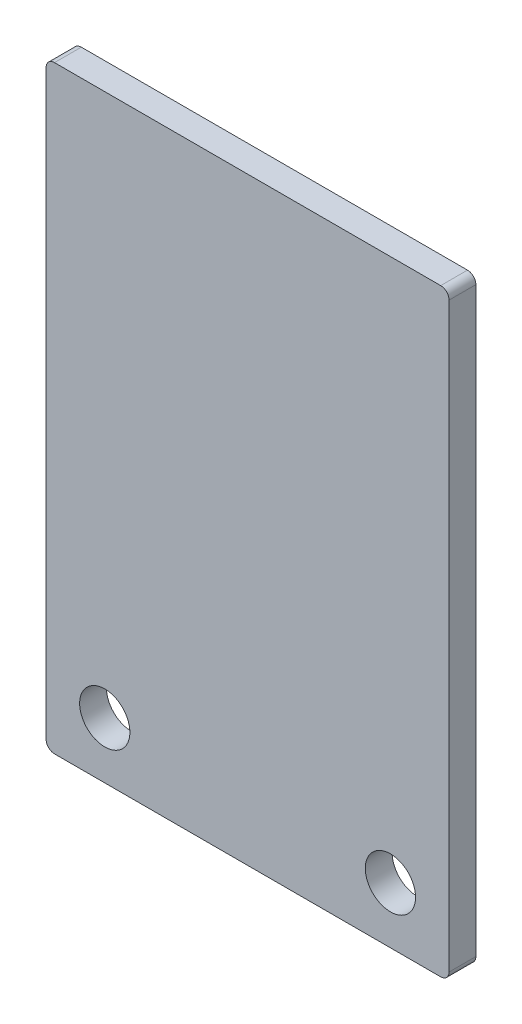
from build123d import *

# Parameters (mm, degrees)
MEASURED_BUTTON_PCB_DEPTH         = 1.6
SKETCH_2_R                        = 1.5
MEASURED_BUTTON_MOUNT_HOLES_DEPTH = 2


with BuildPart() as part:
    # 草图1 → Measured_button_PCB (new body)
    with BuildSketch(Plane.XY):
        with BuildLine():
            Line((0.5, 0), (23.55, 0))
            ThreePointArc((23.55, 0), (23.903553391, 0.146446609), (24.05, 0.5))
            Line((24.05, 0.5), (24.05, 35.23))
            ThreePointArc((24.05, 35.23), (23.903553391, 35.583553391), (23.55, 35.73))
            Line((23.55, 35.73), (0.5, 35.73))
            ThreePointArc((0.5, 35.73), (0.146446609, 35.583553391), (0, 35.23))
            Line((0, 35.23), (0, 0.5))
            ThreePointArc((0, 0.5), (0.146446609, 0.146446609), (0.5, 0))
        make_face()
    extrude(amount=MEASURED_BUTTON_PCB_DEPTH)

    # 草图2 → Measured_button_mount_holes (cut)
    with BuildSketch(Plane.XY):
        with Locations((3.5, 3.36)):
            Circle(SKETCH_2_R)
        with Locations((20.55, 3.36)):
            Circle(SKETCH_2_R)
    extrude(amount=MEASURED_BUTTON_MOUNT_HOLES_DEPTH, mode=Mode.SUBTRACT)


solid = part.part
